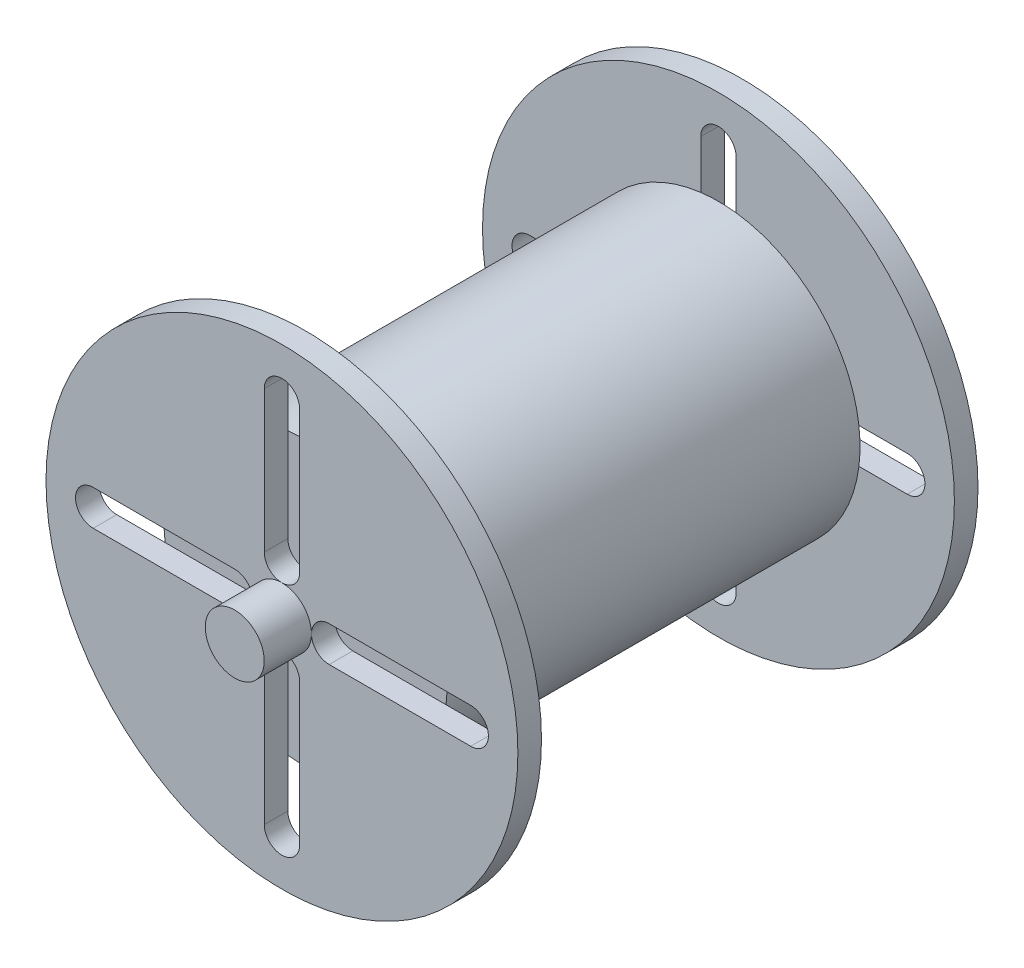
from build123d import *

# Parameters (mm, degrees)
SKETCH1_R           = 60
BOSS_EXTRUDE1_DEPTH = 87.5
SKETCH2_R           = 100
BOSS_EXTRUDE2_DEPTH = 10
SKETCH3_R           = 12.5
BOSS_EXTRUDE3_DEPTH = 20


with BuildPart() as part:
    # Sketch1 → Boss-Extrude1 (new, symmetric)
    with BuildSketch(Plane.XY):
        Circle(SKETCH1_R)
    extrude(amount=BOSS_EXTRUDE1_DEPTH, both=True)

    # Sketch2 → Boss-Extrude2 (add)
    with BuildSketch(Plane.XY.offset(87.5)):
        Circle(SKETCH2_R)
        with BuildLine():
            Line((7.5, 80), (7.5, 20))
            ThreePointArc((7.5, 20), (0, 12.5), (-7.5, 20))
            Line((-7.5, 20), (-7.5, 80))
            ThreePointArc((-7.5, 80), (0, 87.5), (7.5, 80))
        make_face(mode=Mode.SUBTRACT)
        with BuildLine():
            Line((80, 7.5), (20, 7.5))
            ThreePointArc((20, 7.5), (12.5, 0), (20, -7.5))
            Line((20, -7.5), (80, -7.5))
            ThreePointArc((80, -7.5), (87.5, 0), (80, 7.5))
        make_face(mode=Mode.SUBTRACT)
        with BuildLine():
            Line((7.5, -80), (7.5, -20))
            ThreePointArc((7.5, -20), (0, -12.5), (-7.5, -20))
            Line((-7.5, -20), (-7.5, -80))
            ThreePointArc((-7.5, -80), (0, -87.5), (7.5, -80))
        make_face(mode=Mode.SUBTRACT)
        with BuildLine():
            Line((-80, -7.5), (-20, -7.5))
            ThreePointArc((-20, -7.5), (-12.5, 0), (-20, 7.5))
            Line((-20, 7.5), (-80, 7.5))
            ThreePointArc((-80, 7.5), (-87.5, 0), (-80, -7.5))
        make_face(mode=Mode.SUBTRACT)
    boss_extrude2 = extrude(amount=BOSS_EXTRUDE2_DEPTH)

    # Sketch3 → Boss-Extrude3 (add)
    with BuildSketch(Plane.XY.offset(97.5)):
        with Locations(Location((0, 0, 0), (0, 0, 179.999859654))):
            Circle(SKETCH3_R)
    boss_extrude3 = extrude(amount=BOSS_EXTRUDE3_DEPTH)

    # Mirror1: Boss-Extrude2 across plane
    add(boss_extrude2.mirror(Plane.XY))

    # Mirror2: Boss-Extrude3 across plane
    add(boss_extrude3.mirror(Plane.XY))


solid = part.part
